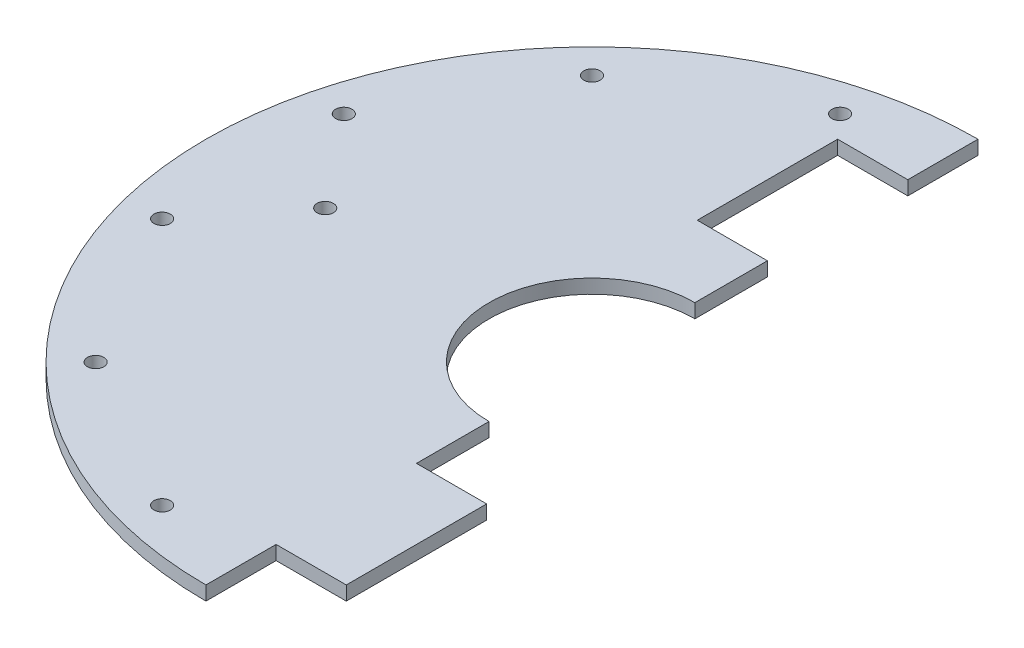
from build123d import *

# Parameters (mm, degrees)
SKETCH1_R           = 82.5
BOSS_EXTRUDE1_DEPTH = 3
SKETCH2_R           = 1.75
SKETCH2_R_2         = 22
CUT_EXTRUDE1_DEPTH  = 3
SKETCH3_R           = 1.75
CUT_EXTRUDE2_DEPTH  = 117.711181984
CIRPATTERN1_COUNT   = 12
CUT_EXTRUDE3_DEPTH  = 3


with BuildPart() as part:
    # Sketch1 → Boss-Extrude1 (new body)
    with BuildSketch(Plane(origin=(0, 0, 0), x_dir=(1, 0, 0), z_dir=(0, 1, 0))):
        with Locations(Location((0, 0, 0), (0, 0, 270))):
            Circle(SKETCH1_R)
    extrude(amount=BOSS_EXTRUDE1_DEPTH)

    # Sketch2 → Cut-Extrude1 (cut)
    with BuildSketch(Plane(origin=(0, 3, 0), x_dir=(1, 0, 0), z_dir=(0, 1, 0))):
        with Locations(Location((57, 0, 0), (0, 0, 270))):
            Circle(SKETCH2_R)
        with Locations(Location((0, 0, 0), (0, 0, 270))):
            Circle(SKETCH2_R_2)
        with Locations(Location((-57, 0, 0), (0, 0, 270))):
            Circle(SKETCH2_R)
    extrude(amount=-CUT_EXTRUDE1_DEPTH, mode=Mode.SUBTRACT)

    # Sketch3 → Cut-Extrude2 (cut, through all)
    with BuildSketch(Plane(origin=(0, 3, 0), x_dir=(1, 0, 0), z_dir=(0, 1, 0))):
        with Locations(Location((72.444436972, -19.411428383, 0), (0, 0, 270))):
            Circle(SKETCH3_R)
    cut_extrude2 = extrude(amount=-CUT_EXTRUDE2_DEPTH, mode=Mode.SUBTRACT)

    # CirPattern1: Cut-Extrude2 ×12 about axis
    cirpattern1_axis = Axis((0, 0, 0), (0, 1, 0))
    for i in range(1, CIRPATTERN1_COUNT):
        add(cut_extrude2.rotate(cirpattern1_axis, i * 360 / CIRPATTERN1_COUNT), mode=Mode.SUBTRACT)

    # Sketch4 → Cut-Extrude3 (cut)
    with BuildSketch(Plane(origin=(0, 3, 0), x_dir=(1, 0, 0), z_dir=(0, 1, 0))):
        with BuildLine():
            Line((0, 67.5), (-15, 67.5))
            Line((-15, 67.5), (-15, 37.5))
            Line((-15, 37.5), (0, 37.5))
            Line((0, 37.5), (0, 22))
            ThreePointArc((0, 22), (22, 0), (0, -22))
            Line((0, -22), (0, -37.5))
            Line((0, -37.5), (15, -37.5))
            Line((15, -37.5), (15, -67.5))
            Line((15, -67.5), (0, -67.5))
            Line((0, -67.5), (0, -82.5))
            ThreePointArc((0, -82.5), (82.5, 0), (0, 82.5))
            Line((0, 82.5), (0, 67.5))
        make_face()
    extrude(amount=-CUT_EXTRUDE3_DEPTH, mode=Mode.SUBTRACT)


solid = part.part
